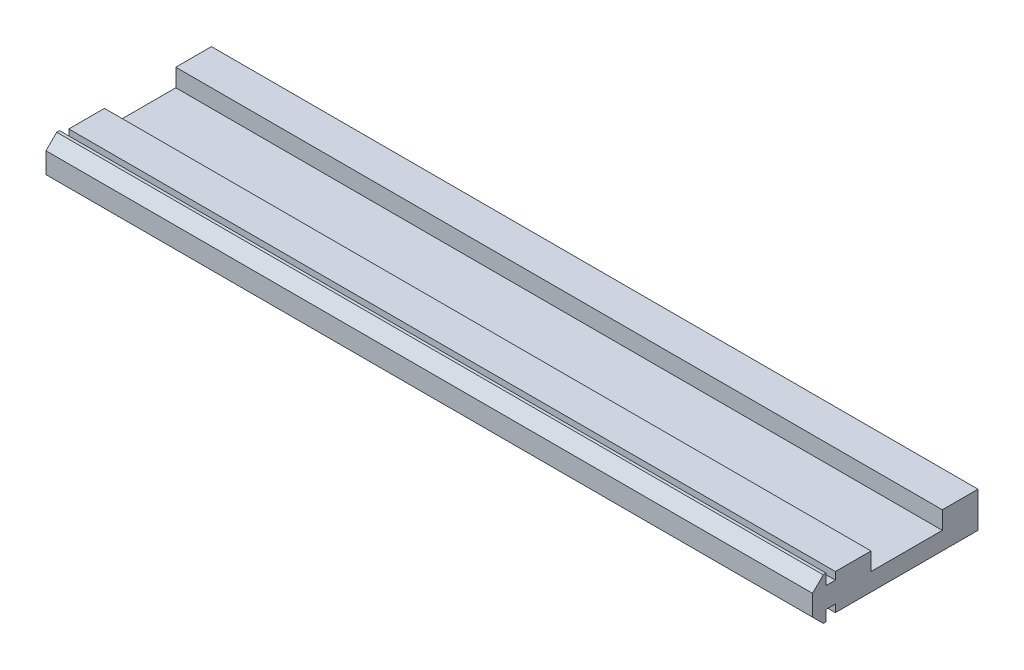
from build123d import *

# Parameters (mm, degrees)
SKETCH1_R           = 2.1
BOSS_EXTRUDE1_DEPTH = 65
SKETCH84_W          = 0.3
SKETCH84_H          = 5.4
BOSS_EXTRUDE6_DEPTH = 430
SKETCH85_W          = 26.589814492
SKETCH85_H          = 26.977421118
CUT_EXTRUDE59_DEPTH = 434.070721707
SKETCH86_W          = 10.5
SKETCH86_H          = 16.670499862
CUT_EXTRUDE60_DEPTH = 20
BOSS_EXTRUDE7_DEPTH = 430
SKETCH88_W          = 50.836385829
SKETCH88_H          = 23.143723533
CUT_EXTRUDE61_DEPTH = 452.123510754
SKETCH89_W          = 10.587528554
SKETCH89_H          = 18.486902418
CUT_EXTRUDE62_DEPTH = 20
SKETCH91_W          = 57.789643697
SKETCH91_H          = 26.784525871
CUT_EXTRUDE64_DEPTH = 215
BOSS_EXTRUDE8_DEPTH = 215


with BuildPart() as part:
    # Sketch1 → Boss-Extrude1 (new body)
    with BuildSketch(Plane(origin=(0, 0, 0), x_dir=(0, 0, -1), z_dir=(1, 0, 0))):
        with BuildLine():
            Line((-10, 9), (-10, 3))
            Line((-10, 3), (-8, 3))
            Line((-8, 3), (-8, 6))
            Line((-8, 6), (-7.060660172, 6))
            Line((-7.060660172, 6), (-4, 2.939339828))
            Line((-4, 2.939339828), (-4, -2.939339828))
            Line((-4, -2.939339828), (-7.060660172, -6))
            Line((-7.060660172, -6), (-8, -6))
            Line((-8, -6), (-8, -3))
            Line((-8, -3), (-10, -3))
            Line((-10, -3), (-10, -9))
            ThreePointArc((-10, -9), (-9.707106781, -9.707106781), (-9, -10))
            Line((-9, -10), (-3, -10))
            Line((-3, -10), (-3, -8))
            Line((-3, -8), (-6, -8))
            Line((-6, -8), (-6, -7.060660172))
            Line((-6, -7.060660172), (-2.939339828, -4))
            Line((-2.939339828, -4), (2.939339828, -4))
            Line((2.939339828, -4), (6, -7.060660172))
            Line((6, -7.060660172), (6, -8))
            Line((6, -8), (3, -8))
            Line((3, -8), (3, -10))
            Line((3, -10), (9, -10))
            ThreePointArc((9, -10), (9.707106781, -9.707106781), (10, -9))
            Line((10, -9), (10, -3))
            Line((10, -3), (8, -3))
            Line((8, -3), (8, -6))
            Line((8, -6), (7.060660172, -6))
            Line((7.060660172, -6), (4, -2.939339828))
            Line((4, -2.939339828), (4, 2.939339828))
            Line((4, 2.939339828), (7.060660172, 6))
            Line((7.060660172, 6), (8, 6))
            Line((8, 6), (8, 3))
            Line((8, 3), (10, 3))
            Line((10, 3), (10, 9))
            ThreePointArc((10, 9), (9.707106781, 9.707106781), (9, 10))
            Line((9, 10), (3, 10))
            Line((3, 10), (3, 8))
            Line((3, 8), (6, 8))
            Line((6, 8), (6, 7.060660172))
            Line((6, 7.060660172), (2.939339828, 4))
            Line((2.939339828, 4), (-2.939339828, 4))
            Line((-2.939339828, 4), (-6, 7.060660172))
            Line((-6, 7.060660172), (-6, 8))
            Line((-6, 8), (-3, 8))
            Line((-3, 8), (-3, 10))
            Line((-3, 10), (-9, 10))
            ThreePointArc((-9, 10), (-9.707106781, 9.707106781), (-10, 9))
        make_face()
        Circle(SKETCH1_R, mode=Mode.SUBTRACT)
    extrude(amount=BOSS_EXTRUDE1_DEPTH)

    # Sketch85 → Cut-Extrude59 (cut, through all)
    with BuildSketch(Plane(origin=(65, 0, 0), x_dir=(0, 0, -1), z_dir=(1, 0, 0))):
        with Locations((1.176321583, -0.814927094)):
            Rectangle(SKETCH85_W, SKETCH85_H)
    extrude(amount=-CUT_EXTRUDE59_DEPTH, mode=Mode.SUBTRACT)


with BuildPart() as body_2:
    # Sketch84 → Boss-Extrude6 (new body)
    with BuildSketch(Plane(origin=(65, 0, 0), x_dir=(0, 0, -1), z_dir=(1, 0, 0))):
        Polygon((-10, -2.7), (-10, 2.7), (-10.5, 2.7), (-10.5, 5), (-20.5, 5), (-20.5, 0), (-40.5, 0), (-40.5, 5), (-50.5, 5), (-50.5, -5), (-10.5, -5), (-10.5, -2.7), align=None)
        Polygon((-7.18492424, 5.7), (-4.3, 2.81507576), (-4.3, -2.81507576), (-7.18492424, -5.7), (-7.7, -5.7), (-7.7, -2.7), (-9.7, -2.7), (-9.7, 2.7), (-7.7, 2.7), (-7.7, 5.7), align=None)
        with Locations((-9.85, 0)):
            Rectangle(SKETCH84_W, SKETCH84_H)
    extrude(amount=BOSS_EXTRUDE6_DEPTH)

    # Sketch86 → Cut-Extrude60 (cut)
    with BuildSketch(Plane.ZY.offset(-65)):
        with Locations((5.25, -0.117074477)):
            Rectangle(SKETCH86_W, SKETCH86_H)
    extrude(amount=-CUT_EXTRUDE60_DEPTH, mode=Mode.SUBTRACT)

    # Sketch88 → Cut-Extrude61 (cut, through all)
    with BuildSketch(Plane(origin=(495, 0, 0), x_dir=(0, 0, -1), z_dir=(1, 0, 0))):
        with Locations((-27.072054747, -2.705254768)):
            Rectangle(SKETCH88_W, SKETCH88_H)
    extrude(amount=-CUT_EXTRUDE61_DEPTH, mode=Mode.SUBTRACT)


with BuildPart() as body_2_2:
    # Sketch87 → Boss-Extrude7 (new body)
    with BuildSketch(Plane(origin=(495, 0, 0), x_dir=(0, 0, -1), z_dir=(1, 0, 0))):
        Polygon((-90.108224091, 5), (-90.108224091, -5), (-130.108224091, -5), (-130.108224091, -2.7), (-132.908224091, -2.7), (-132.908224091, -5.7), (-133.42329985, -5.7), (-136.308224091, -2.81507576), (-136.308224091, 2.81507576), (-133.42329985, 5.7), (-132.908224091, 5.7), (-132.908224091, 2.7), (-130.108224091, 2.7), (-130.108224091, 5), (-120.108224091, 5), (-120.108224091, 0), (-100.108224091, 0), (-100.108224091, 5), align=None)
    extrude(amount=BOSS_EXTRUDE7_DEPTH)

    # Sketch89 → Cut-Extrude62 (cut)
    with BuildSketch(Plane.ZY.offset(-495)):
        with Locations((135.401988368, 0.001330813)):
            Rectangle(SKETCH89_W, SKETCH89_H)
    extrude(amount=-CUT_EXTRUDE62_DEPTH, mode=Mode.SUBTRACT)

    # Sketch91 → Cut-Extrude64 (cut)
    with BuildSketch(Plane.ZY.offset(-495)):
        with Locations((111.787573331, -1.223700195)):
            Rectangle(SKETCH91_W, SKETCH91_H)
    extrude(amount=-CUT_EXTRUDE64_DEPTH, mode=Mode.SUBTRACT)

    # Sketch92 → Boss-Extrude8 (add)
    with BuildSketch(Plane(origin=(925, 0, 0), x_dir=(0, 0, -1), z_dir=(1, 0, 0))):
        Polygon((-129.908224091, 2.9), (-132.708224091, 2.9), (-132.708224091, 5.9), (-133.506142563, 5.9), (-136.508224091, 2.897918472), (-136.508224091, -2.897918472), (-133.506142563, -5.9), (-132.708224091, -5.9), (-132.708224091, -2.9), (-129.908224091, -2.9), align=None)
        Polygon((-130.108224091, 2.7), (-130.108224091, -2.7), (-132.908224091, -2.7), (-132.908224091, -5.7), (-133.42329985, -5.7), (-136.308224091, -2.81507576), (-136.308224091, 2.81507576), (-133.42329985, 5.7), (-132.908224091, 5.7), (-132.908224091, 2.7), align=None, mode=Mode.SUBTRACT)
    extrude(amount=-BOSS_EXTRUDE8_DEPTH)


solid = body_2_2.part
